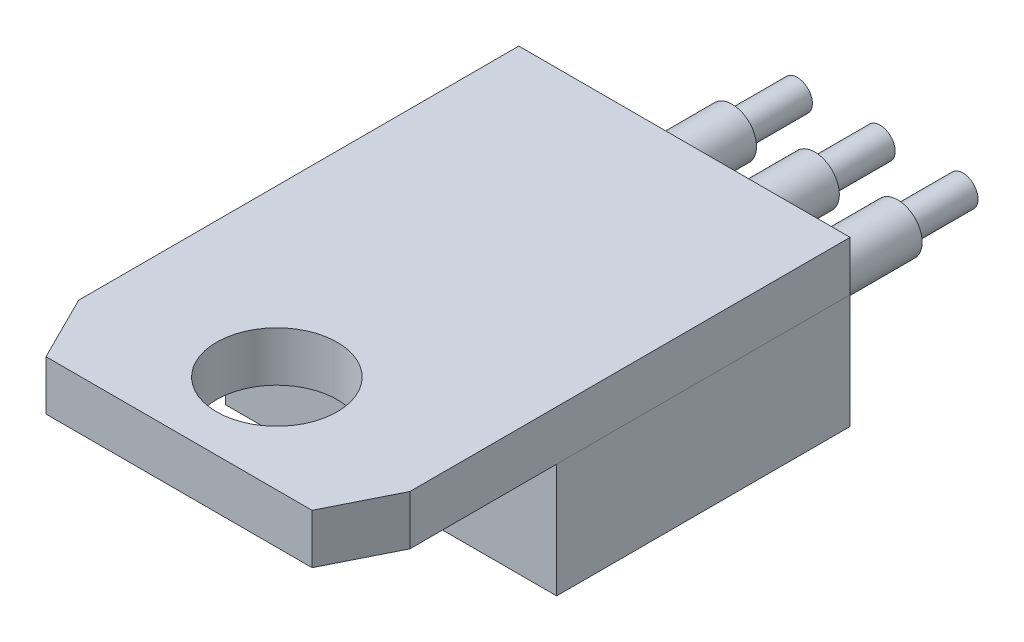
from build123d import *

# Parameters (mm, degrees)
SKETCH1_R           = 1.85
BOSS_EXTRUDE1_DEPTH = 1.524
SKETCH2_W           = 10.16
SKETCH2_H           = 9
BOSS_EXTRUDE2_DEPTH = 3.5
SKETCH3_R           = 0.75
BOSS_EXTRUDE3_DEPTH = 4
SKETCH6_R           = 0.46355
BOSS_EXTRUDE6_DEPTH = 2


with BuildPart() as part:
    # Sketch1 → Boss-Extrude1 (new body)
    with BuildSketch(Plane.XZ.offset(-165.590407598)):
        Polygon((-4.08, 15.5), (-5.08, 13.5), (-5.08, 0), (5.08, 0), (5.08, 13.5), (4.08, 15.5), align=None)
        with Locations(Location((0, 12.5, 0), (0, 0, 90))):
            Circle(SKETCH1_R, mode=Mode.SUBTRACT)
    extrude(amount=-BOSS_EXTRUDE1_DEPTH)

    # Sketch2 → Boss-Extrude2 (add)
    with BuildSketch(Plane.XZ.offset(-165.590407598)):
        with Locations((0, 4.5)):
            Rectangle(SKETCH2_W, SKETCH2_H)
    extrude(amount=BOSS_EXTRUDE2_DEPTH)

    # Sketch3 → Boss-Extrude3 (add)
    with BuildSketch(Plane(origin=(0, 0, 0), x_dir=(-1, 0, 0), z_dir=(0, 0, -1))):
        with Locations(Location((2.54, 164.090407598, 0), (0, 0, 180))):
            Circle(SKETCH3_R)
        with Locations((0, 164.090407598)):
            Circle(SKETCH3_R)
        with Locations((-2.54, 164.090407598)):
            Circle(SKETCH3_R)
    extrude(amount=BOSS_EXTRUDE3_DEPTH)

    # Sketch6 → Boss-Extrude6 (add)
    with BuildSketch(Plane(origin=(0, 0, -4), x_dir=(-1, 0, 0), z_dir=(0, 0, -1))):
        with Locations(Location((2.54, 164.090407598, 0), (0, 0, 180))):
            Circle(SKETCH6_R)
        with Locations((0, 164.090407598)):
            Circle(SKETCH6_R)
        with Locations((-2.54, 164.090407598)):
            Circle(SKETCH6_R)
    extrude(amount=BOSS_EXTRUDE6_DEPTH)


solid = part.part
